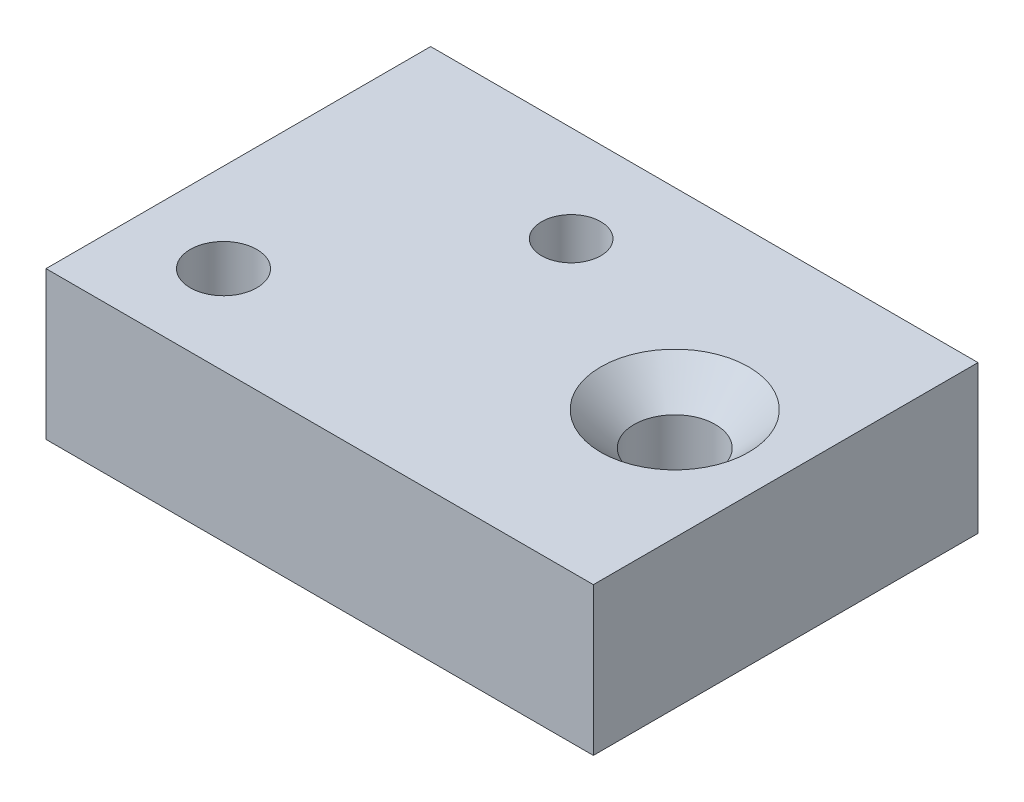
from build123d import *

# Parameters (mm, degrees)
SKETCH1_W                                        = 74
SKETCH1_H                                        = 52
EXTRUDE1_DEPTH                                   = 20
CSK_FOR_M10_FLAT_HEAD_MACHINE_SCREW1_D           = 11
CSK_FOR_M10_FLAT_HEAD_MACHINE_SCREW1_CSINK_D     = 20
CSK_FOR_M10_FLAT_HEAD_MACHINE_SCREW1_CSINK_ANGLE = 90
F_8_0_8_DIAMETER_HOLE1_D                         = 8
CBORE_FOR_M8_SHCS1_D                             = 9
CBORE_FOR_M8_SHCS1_CBORE_D                       = 15
CBORE_FOR_M8_SHCS1_CBORE_DEPTH                   = 8
SKETCH8_R                                        = 8
CUT_EXTRUDE1_DEPTH                               = 6


with BuildPart() as part:
    # Sketch1 → Extrude1 (new body)
    with BuildSketch(Plane(origin=(0, 0, 0), x_dir=(1, 0, 0), z_dir=(0, 1, 0))):
        with Locations((5, 0)):
            Rectangle(SKETCH1_W, SKETCH1_H)
    extrude(amount=EXTRUDE1_DEPTH)

    # CSK for M10 Flat Head Machine Screw1 (through all)
    with Locations(Plane(origin=(0, 20, 0), x_dir=(-1, 0, 0), z_dir=(0, 1, 0))):
        with Locations((-27, 0)):
            CounterSinkHole(CSK_FOR_M10_FLAT_HEAD_MACHINE_SCREW1_D / 2, CSK_FOR_M10_FLAT_HEAD_MACHINE_SCREW1_CSINK_D / 2, counter_sink_angle=CSK_FOR_M10_FLAT_HEAD_MACHINE_SCREW1_CSINK_ANGLE)

    # Ø8.0 (8) Diameter Hole1 (through all)
    with Locations(Plane(origin=(0, 20, 0), x_dir=(-1, 0, 0), z_dir=(0, 1, 0))):
        with Locations((0, -13)):
            Hole(F_8_0_8_DIAMETER_HOLE1_D / 2)

    # CBORE for M8 SHCS1 (through all)
    with Locations(Plane.XZ):
        with Locations((-20, 14)):
            CounterBoreHole(CBORE_FOR_M8_SHCS1_D / 2, CBORE_FOR_M8_SHCS1_CBORE_D / 2, CBORE_FOR_M8_SHCS1_CBORE_DEPTH)

    # Sketch8 → Cut-Extrude1 (cut)
    with BuildSketch(Plane(origin=(0, 13, 0), x_dir=(-1, 0, 0), z_dir=(0, 1, 0))):
        with Locations(Location((0, -13, 0), (0, 0, 90))):
            Circle(SKETCH8_R)
    extrude(amount=-CUT_EXTRUDE1_DEPTH, mode=Mode.SUBTRACT)


solid = part.part
